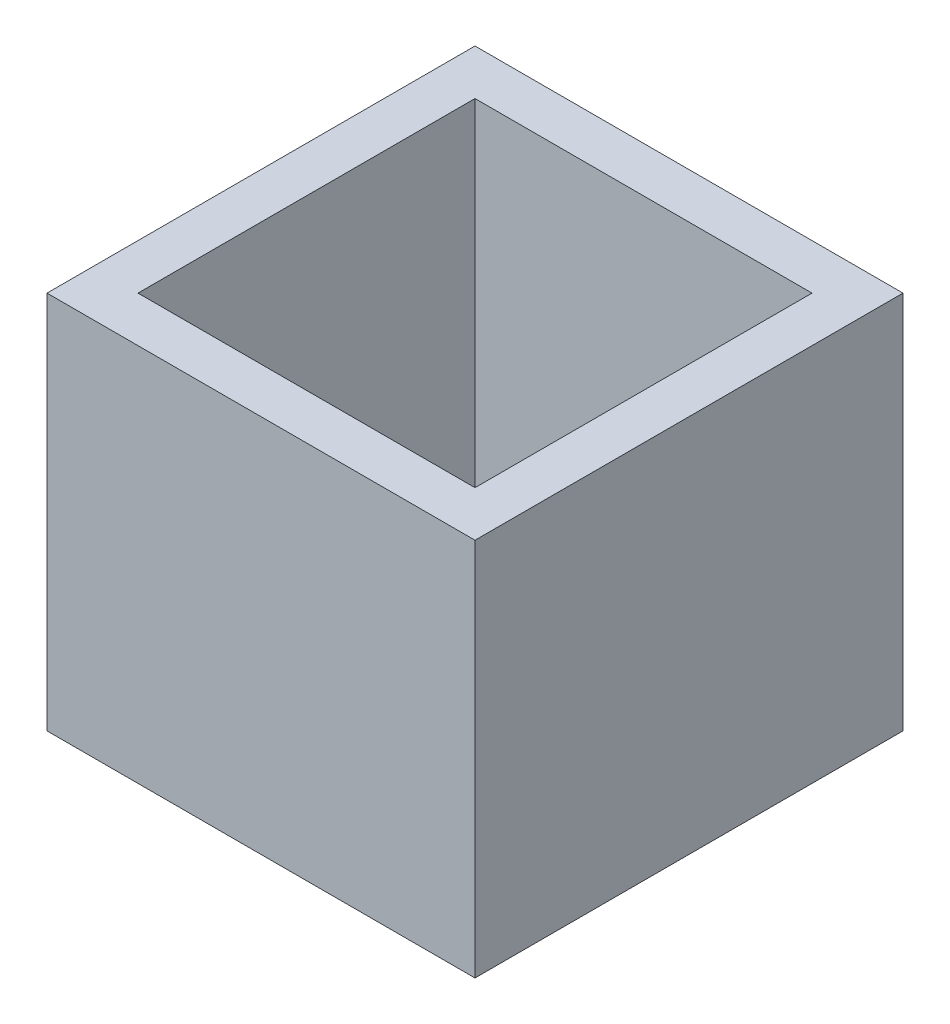
from build123d import *

# Parameters (mm, degrees)
SKETCH1_W           = 20.32
SKETCH1_H           = 20.32
BOSS_EXTRUDE1_DEPTH = 18
SKETCH2_W           = 15.999999972
SKETCH2_H           = 16.000000036
CUT_EXTRUDE1_DEPTH  = 16.5


with BuildPart() as part:
    # Sketch1 → Boss-Extrude1 (new body)
    with BuildSketch(Plane(origin=(0, 0, 0), x_dir=(1, 0, 0), z_dir=(0, 1, 0))):
        Rectangle(SKETCH1_W, SKETCH1_H)
    extrude(amount=BOSS_EXTRUDE1_DEPTH)

    # Sketch2 → Cut-Extrude1 (cut)
    with BuildSketch(Plane(origin=(0, 18, 0), x_dir=(1, 0, 0), z_dir=(0, 1, 0))):
        Rectangle(SKETCH2_W, SKETCH2_H)
    extrude(amount=-CUT_EXTRUDE1_DEPTH, mode=Mode.SUBTRACT)


solid = part.part
